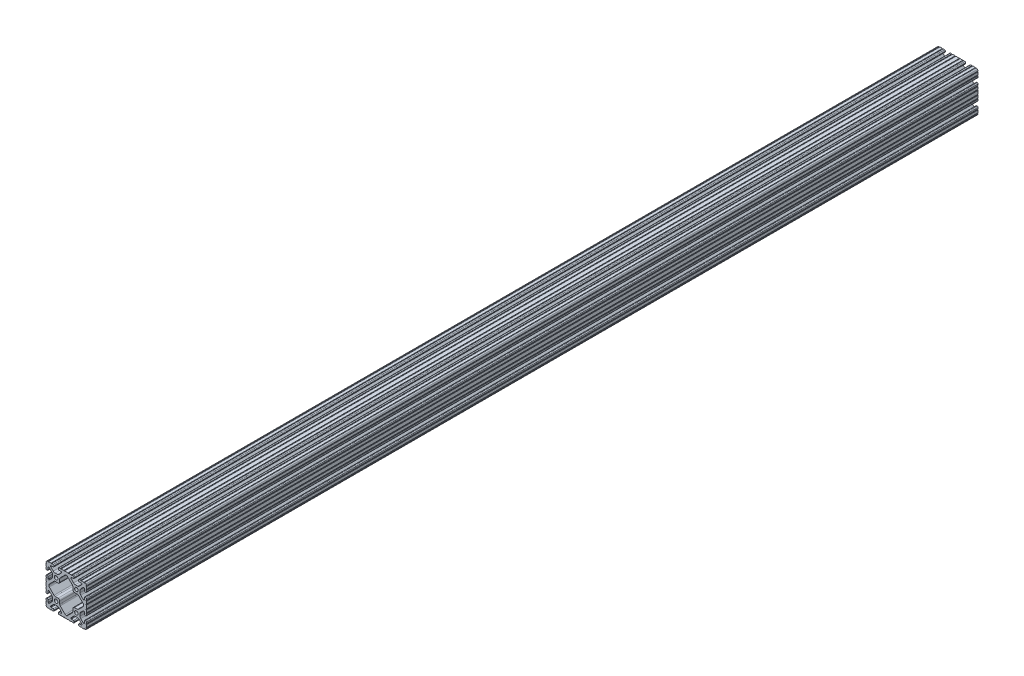
from build123d import *

# Parameters (mm, degrees)
SKETCH1_R           = 3.3274
BOSS_EXTRUDE1_DEPTH = 1676.4


with BuildPart() as part:
    # Sketch1 → Boss-Extrude1 (new body)
    with BuildSketch(Plane(origin=(0, 0, -609.6), x_dir=(-1, 0, 0), z_dir=(0, 0, -1))):
        with BuildLine():
            Line((36.525200182, -23.055396049), (35.610799999, -23.055396049))
            ThreePointArc((35.610799999, -23.055396049), (34.49724824, -23.51664429), (34.035999999, -24.630196049))
            Line((34.035999999, -24.630196049), (34.035999999, -28.448000001))
            ThreePointArc((34.035999999, -28.448000001), (33.775617927, -29.07661793), (33.146999999, -29.337000001))
            Line((33.146999999, -29.337000001), (32.664287243, -29.337000001))
            ThreePointArc((32.664287243, -29.337000001), (32.324081166, -29.269328696), (32.035668541, -29.076617157))
            Line((32.035668541, -29.076617157), (27.197580079, -24.238516795))
            ThreePointArc((27.197580079, -24.238516795), (26.167955878, -22.697572205), (25.806399999, -20.879905136))
            Line((25.806399999, -20.879905136), (25.806399999, -17.220094864))
            ThreePointArc((25.806399999, -17.220094864), (26.167955878, -15.402427795), (27.197580079, -13.861483205))
            Line((27.197580079, -13.861483205), (31.948944539, -9.110107059))
            ThreePointArc((31.948944539, -9.110107059), (32.333417094, -8.853210197), (32.786933647, -8.763000001))
            Line((32.786933647, -8.763000001), (33.060275786, -8.763000001))
            ThreePointArc((33.060275786, -8.763000001), (33.750216993, -9.048783007), (34.035999999, -9.738724214))
            Line((34.035999999, -9.738724214), (34.035999999, -13.469803585))
            ThreePointArc((34.035999999, -13.469803585), (34.497248347, -14.583355602), (35.610800365, -15.044603951))
            Line((35.610800365, -15.044603951), (36.525199999, -15.044603951))
            ThreePointArc((36.525199999, -15.044603951), (37.638751758, -14.58335571), (38.099999999, -13.469803951))
            Line((38.099999999, -13.469803951), (38.099999999, -11.075039291))
            ThreePointArc((38.099999999, -11.075039291), (37.117000249, -10.313517274), (38.099999999, -9.551995256))
            Line((38.099999999, -9.551995256), (38.099999999, -4.723759309))
            ThreePointArc((38.099999999, -4.723759309), (37.117000249, -3.962237291), (38.099999999, -3.200715274))
            Line((38.099999999, -3.200715274), (38.099999999, 3.200715274))
            ThreePointArc((38.099999999, 3.200715274), (37.117000249, 3.962237291), (38.099999999, 4.723759309))
            Line((38.099999999, 4.723759309), (38.099999999, 9.551995254))
            ThreePointArc((38.099999999, 9.551995254), (37.117000249, 10.313517271), (38.099999999, 11.075039288))
            Line((38.099999999, 11.075039288), (38.099999999, 13.469803951))
            ThreePointArc((38.099999999, 13.469803951), (37.638751758, 14.58335571), (36.525199999, 15.044603951))
            Line((36.525199999, 15.044603951), (35.610800365, 15.044603951))
            ThreePointArc((35.610800365, 15.044603951), (34.497248347, 14.583355602), (34.035999999, 13.469803585))
            Line((34.035999999, 13.469803585), (34.035999999, 9.738724211))
            ThreePointArc((34.035999999, 9.738724211), (33.750216993, 9.048783004), (33.060275786, 8.762999999))
            Line((33.060275786, 8.762999999), (32.78693365, 8.762999999))
            ThreePointArc((32.78693365, 8.762999999), (32.333417097, 8.853210195), (31.948944542, 9.110107056))
            Line((31.948944542, 9.110107056), (27.197580079, 13.861483205))
            ThreePointArc((27.197580079, 13.861483205), (26.167955878, 15.402427795), (25.806399999, 17.220094864))
            Line((25.806399999, 17.220094864), (25.806399999, 20.879905136))
            ThreePointArc((25.806399999, 20.879905136), (26.167955878, 22.697572205), (27.19758008, 24.238516796))
            Line((27.19758008, 24.238516796), (32.035668541, 29.076617154))
            ThreePointArc((32.035668541, 29.076617154), (32.324081166, 29.269328694), (32.664287243, 29.336999999))
            Line((32.664287243, 29.336999999), (33.146999999, 29.336999999))
            ThreePointArc((33.146999999, 29.336999999), (33.775617927, 29.076617927), (34.035999999, 28.447999999))
            Line((34.035999999, 28.447999999), (34.035999999, 24.630196049))
            ThreePointArc((34.035999999, 24.630196049), (34.49724824, 23.51664429), (35.610799999, 23.055396049))
            Line((35.610799999, 23.055396049), (36.525200182, 23.055396049))
            ThreePointArc((36.525200182, 23.055396049), (37.638751811, 23.516644237), (38.099999999, 24.630195866))
            Line((38.099999999, 24.630195866), (38.099999999, 27.023826138))
            ThreePointArc((38.099999999, 27.023826138), (37.117780707, 27.7845421), (38.099999999, 28.545258063))
            Line((38.099999999, 28.545258063), (38.099999999, 33.373016026))
            ThreePointArc((38.099999999, 33.373016026), (37.141472622, 34.109236775), (38.1, 34.845457522))
            ThreePointArc((38.1, 34.845457522), (37.837757798, 36.120195039), (37.086123087, 37.182631848))
            ThreePointArc((37.086123087, 37.182631848), (36.106286535, 37.843374412), (34.952681874, 38.099999999))
            ThreePointArc((34.952681874, 38.099999999), (34.190730434, 37.320215334), (33.428778993, 38.099999999))
            Line((33.428778993, 38.099999999), (28.601105934, 38.099999999))
            ThreePointArc((28.601105934, 38.099999999), (27.83915858, 37.320219419), (27.077211226, 38.099999999))
            Line((27.077211226, 38.099999999), (24.688799999, 38.099999999))
            ThreePointArc((24.688799999, 38.099999999), (23.57524824, 37.638751758), (23.113999999, 36.525199999))
            Line((23.113999999, 36.525199999), (23.113999999, 35.610799999))
            ThreePointArc((23.113999999, 35.610799999), (23.57524824, 34.49724824), (24.688799999, 34.035999999))
            Line((24.688799999, 34.035999999), (28.447999999, 34.035999999))
            ThreePointArc((28.447999999, 34.035999999), (29.076617927, 33.775617927), (29.336999999, 33.146999999))
            Line((29.336999999, 33.146999999), (29.336999999, 32.720693457))
            ThreePointArc((29.336999999, 32.720693457), (29.326675076, 32.273872753), (29.100231244, 31.888543625))
            Line((29.100231244, 31.888543625), (24.409287498, 27.19758834))
            ThreePointArc((24.409287498, 27.19758834), (22.868340044, 26.167958113), (21.050667578, 25.806399999))
            Line((21.050667578, 25.806399999), (17.049332422, 25.806399999))
            ThreePointArc((17.049332422, 25.806399999), (15.231659956, 26.167958113), (13.690712502, 27.19758834))
            Line((13.690712502, 27.19758834), (9.023381297, 31.864931026))
            ThreePointArc((9.023381297, 31.864931026), (8.830670885, 32.153343115), (8.762999999, 32.493548181))
            Line((8.762999999, 32.493548181), (8.762999999, 33.146999999))
            ThreePointArc((8.762999999, 33.146999999), (9.02338207, 33.775617927), (9.651999999, 34.035999999))
            Line((9.651999999, 34.035999999), (13.411199999, 34.035999999))
            ThreePointArc((13.411199999, 34.035999999), (14.524751758, 34.49724824), (14.985999999, 35.610799999))
            Line((14.985999999, 35.610799999), (14.985999999, 36.525199999))
            ThreePointArc((14.985999999, 36.525199999), (14.524751758, 37.638751758), (13.411199999, 38.099999999))
            Line((13.411199999, 38.099999999), (11.128867073, 38.099999999))
            ThreePointArc((11.128867073, 38.099999999), (10.367071032, 37.320370692), (9.605274992, 38.099999999))
            Line((9.605274992, 38.099999999), (4.777313068, 38.099999999))
            ThreePointArc((4.777313068, 38.099999999), (4.015517027, 37.320370692), (3.253720987, 38.099999999))
            Line((3.253720987, 38.099999999), (-3.253720989, 38.099999999))
            ThreePointArc((-3.253720989, 38.099999999), (-4.01551703, 37.320370692), (-4.777313071, 38.099999999))
            Line((-4.777313071, 38.099999999), (-9.605274992, 38.099999999))
            ThreePointArc((-9.605274992, 38.099999999), (-10.367071032, 37.320370692), (-11.128867073, 38.099999999))
            Line((-11.128867073, 38.099999999), (-13.411200001, 38.099999999))
            ThreePointArc((-13.411200001, 38.099999999), (-14.52475176, 37.638751758), (-14.986000001, 36.525199999))
            Line((-14.986000001, 36.525199999), (-14.986000001, 35.610799999))
            ThreePointArc((-14.986000001, 35.610799999), (-14.52475176, 34.49724824), (-13.411200001, 34.035999999))
            Line((-13.411200001, 34.035999999), (-9.652000001, 34.035999999))
            ThreePointArc((-9.652000001, 34.035999999), (-9.023382073, 33.775617927), (-8.763000001, 33.146999999))
            Line((-8.763000001, 33.146999999), (-8.763000001, 32.493548178))
            ThreePointArc((-8.763000001, 32.493548178), (-8.830670888, 32.153343112), (-9.0233813, 31.864931023))
            Line((-9.0233813, 31.864931023), (-13.690712502, 27.19758834))
            ThreePointArc((-13.690712502, 27.19758834), (-15.231659956, 26.167958113), (-17.049332422, 25.806399999))
            Line((-17.049332422, 25.806399999), (-21.050667578, 25.806399999))
            ThreePointArc((-21.050667578, 25.806399999), (-22.868340044, 26.167958113), (-24.409287498, 27.19758834))
            Line((-24.409287498, 27.19758834), (-29.100231244, 31.888543625))
            ThreePointArc((-29.100231244, 31.888543625), (-29.326675074, 32.273872748), (-29.337000001, 32.720693446))
            Line((-29.337000001, 32.720693446), (-29.337000001, 33.146999999))
            ThreePointArc((-29.337000001, 33.146999999), (-29.07661793, 33.775617927), (-28.448000001, 34.035999999))
            Line((-28.448000001, 34.035999999), (-24.688800001, 34.035999999))
            ThreePointArc((-24.688800001, 34.035999999), (-23.575248242, 34.49724824), (-23.114000001, 35.610799999))
            Line((-23.114000001, 35.610799999), (-23.114000001, 36.525199999))
            ThreePointArc((-23.114000001, 36.525199999), (-23.575248242, 37.638751758), (-24.688800001, 38.099999999))
            Line((-24.688800001, 38.099999999), (-27.077211226, 38.099999999))
            ThreePointArc((-27.077211226, 38.099999999), (-27.83915858, 37.320219419), (-28.601105934, 38.099999999))
            Line((-28.601105934, 38.099999999), (-33.428778993, 38.099999999))
            ThreePointArc((-33.428778993, 38.099999999), (-34.190730434, 37.320215334), (-34.952681874, 38.099999999))
            ThreePointArc((-34.952681874, 38.099999999), (-36.106286561, 37.843374402), (-37.086123128, 37.18263181))
            ThreePointArc((-37.086123128, 37.18263181), (-37.837757809, 36.120195013), (-38.1, 34.845457522))
            ThreePointArc((-38.1, 34.845457522), (-37.141472622, 34.109236773), (-38.100000001, 33.373016026))
            Line((-38.100000001, 33.373016026), (-38.100000001, 28.545258062))
            ThreePointArc((-38.100000001, 28.545258062), (-37.117780707, 27.7845421), (-38.100000001, 27.023826138))
            Line((-38.100000001, 27.023826138), (-38.100000001, 24.630195866))
            ThreePointArc((-38.100000001, 24.630195866), (-37.638751814, 23.516644237), (-36.525200184, 23.055396049))
            Line((-36.525200184, 23.055396049), (-35.610800001, 23.055396049))
            ThreePointArc((-35.610800001, 23.055396049), (-34.497248242, 23.51664429), (-34.036000001, 24.630196049))
            Line((-34.036000001, 24.630196049), (-34.036000001, 28.447999999))
            ThreePointArc((-34.036000001, 28.447999999), (-33.77561793, 29.076617927), (-33.147000001, 29.336999999))
            Line((-33.147000001, 29.336999999), (-32.664287243, 29.336999999))
            ThreePointArc((-32.664287243, 29.336999999), (-32.324081166, 29.269328694), (-32.035668541, 29.076617154))
            Line((-32.035668541, 29.076617154), (-27.197580082, 24.238516798))
            ThreePointArc((-27.197580082, 24.238516798), (-26.16795588, 22.697572208), (-25.806400001, 20.879905138))
            Line((-25.806400001, 20.879905138), (-25.806400001, 17.220094862))
            ThreePointArc((-25.806400001, 17.220094862), (-26.16795588, 15.402427793), (-27.197580082, 13.861483203))
            Line((-27.197580082, 13.861483203), (-31.948944542, 9.110107056))
            ThreePointArc((-31.948944542, 9.110107056), (-32.333417097, 8.853210195), (-32.78693365, 8.762999999))
            Line((-32.78693365, 8.762999999), (-33.060275789, 8.762999999))
            ThreePointArc((-33.060275789, 8.762999999), (-33.750216996, 9.048783004), (-34.036000001, 9.738724211))
            Line((-34.036000001, 9.738724211), (-34.036000001, 13.469803585))
            ThreePointArc((-34.036000001, 13.469803585), (-34.497248349, 14.583355602), (-35.610800367, 15.044603951))
            Line((-35.610800367, 15.044603951), (-36.525200001, 15.044603951))
            ThreePointArc((-36.525200001, 15.044603951), (-37.63875176, 14.58335571), (-38.100000001, 13.469803951))
            Line((-38.100000001, 13.469803951), (-38.100000001, 11.075039288))
            ThreePointArc((-38.100000001, 11.075039288), (-37.117000249, 10.313517271), (-38.100000001, 9.551995254))
            Line((-38.100000001, 9.551995254), (-38.100000001, 4.723759308))
            ThreePointArc((-38.100000001, 4.723759308), (-37.117000249, 3.962237291), (-38.100000001, 3.200715275))
            Line((-38.100000001, 3.200715275), (-38.100000001, -3.200715275))
            ThreePointArc((-38.100000001, -3.200715275), (-37.117000249, -3.962237291), (-38.100000001, -4.723759308))
            Line((-38.100000001, -4.723759308), (-38.100000001, -9.551995257))
            ThreePointArc((-38.100000001, -9.551995257), (-37.117000249, -10.313517274), (-38.100000001, -11.07503929))
            Line((-38.100000001, -11.07503929), (-38.100000001, -13.469803951))
            ThreePointArc((-38.100000001, -13.469803951), (-37.63875176, -14.58335571), (-36.525200001, -15.044603951))
            Line((-36.525200001, -15.044603951), (-35.610800367, -15.044603951))
            ThreePointArc((-35.610800367, -15.044603951), (-34.497248349, -14.583355602), (-34.036000001, -13.469803585))
            Line((-34.036000001, -13.469803585), (-34.036000001, -9.738724214))
            ThreePointArc((-34.036000001, -9.738724214), (-33.750216996, -9.048783007), (-33.060275789, -8.763000001))
            Line((-33.060275789, -8.763000001), (-32.786933647, -8.763000001))
            ThreePointArc((-32.786933647, -8.763000001), (-32.333417094, -8.853210197), (-31.948944539, -9.110107059))
            Line((-31.948944539, -9.110107059), (-27.197580082, -13.861483203))
            ThreePointArc((-27.197580082, -13.861483203), (-26.16795588, -15.402427793), (-25.806400001, -17.220094862))
            Line((-25.806400001, -17.220094862), (-25.806400001, -20.879905138))
            ThreePointArc((-25.806400001, -20.879905138), (-26.16795588, -22.697572207), (-27.197580082, -24.238516797))
            Line((-27.197580082, -24.238516797), (-32.035668541, -29.076617157))
            ThreePointArc((-32.035668541, -29.076617157), (-32.324081166, -29.269328696), (-32.664287243, -29.337000001))
            Line((-32.664287243, -29.337000001), (-33.147000001, -29.337000001))
            ThreePointArc((-33.147000001, -29.337000001), (-33.77561793, -29.07661793), (-34.036000001, -28.448000001))
            Line((-34.036000001, -28.448000001), (-34.036000001, -24.630196049))
            ThreePointArc((-34.036000001, -24.630196049), (-34.497248242, -23.51664429), (-35.610800001, -23.055396049))
            Line((-35.610800001, -23.055396049), (-36.525200184, -23.055396049))
            ThreePointArc((-36.525200184, -23.055396049), (-37.638751814, -23.516644237), (-38.100000001, -24.630195866))
            Line((-38.100000001, -24.630195866), (-38.100000001, -27.023826138))
            ThreePointArc((-38.100000001, -27.023826138), (-37.117780707, -27.7845421), (-38.100000001, -28.545258062))
            Line((-38.100000001, -28.545258062), (-38.100000001, -33.373016026))
            ThreePointArc((-38.100000001, -33.373016026), (-37.141472622, -34.109236773), (-38.1, -34.845457522))
            ThreePointArc((-38.1, -34.845457522), (-37.83775782, -36.120194987), (-37.086123169, -37.182631771))
            ThreePointArc((-37.086123169, -37.182631771), (-36.106286588, -37.843374393), (-34.952681874, -38.100000001))
            ThreePointArc((-34.952681874, -38.100000001), (-34.190730434, -37.320215336), (-33.428778993, -38.100000001))
            Line((-33.428778993, -38.100000001), (-28.601105934, -38.100000001))
            ThreePointArc((-28.601105934, -38.100000001), (-27.83915858, -37.320219421), (-27.077211226, -38.100000001))
            Line((-27.077211226, -38.100000001), (-24.688800001, -38.100000001))
            ThreePointArc((-24.688800001, -38.100000001), (-23.575248242, -37.63875176), (-23.114000001, -36.525200001))
            Line((-23.114000001, -36.525200001), (-23.114000001, -35.610800001))
            ThreePointArc((-23.114000001, -35.610800001), (-23.575248242, -34.497248242), (-24.688800001, -34.036000001))
            Line((-24.688800001, -34.036000001), (-28.448000001, -34.036000001))
            ThreePointArc((-28.448000001, -34.036000001), (-29.07661793, -33.77561793), (-29.337000001, -33.147000001))
            Line((-29.337000001, -33.147000001), (-29.337000001, -32.720693446))
            ThreePointArc((-29.337000001, -32.720693446), (-29.326675074, -32.273872748), (-29.100231244, -31.888543625))
            Line((-29.100231244, -31.888543625), (-24.409287501, -27.197588343))
            ThreePointArc((-24.409287501, -27.197588343), (-22.868340046, -26.167958116), (-21.050667581, -25.806400001))
            Line((-21.050667581, -25.806400001), (-17.049332419, -25.806400001))
            ThreePointArc((-17.049332419, -25.806400001), (-15.231659954, -26.167958116), (-13.690712499, -27.197588343))
            Line((-13.690712499, -27.197588343), (-9.0233813, -31.864931023))
            ThreePointArc((-9.0233813, -31.864931023), (-8.830670888, -32.153343112), (-8.763000001, -32.493548178))
            Line((-8.763000001, -32.493548178), (-8.763000001, -33.147000001))
            ThreePointArc((-8.763000001, -33.147000001), (-9.023382073, -33.77561793), (-9.652000001, -34.036000001))
            Line((-9.652000001, -34.036000001), (-13.411200001, -34.036000001))
            ThreePointArc((-13.411200001, -34.036000001), (-14.52475176, -34.497248242), (-14.986000001, -35.610800001))
            Line((-14.986000001, -35.610800001), (-14.986000001, -36.525200001))
            ThreePointArc((-14.986000001, -36.525200001), (-14.52475176, -37.63875176), (-13.411200001, -38.100000001))
            Line((-13.411200001, -38.100000001), (-11.128867073, -38.100000001))
            ThreePointArc((-11.128867073, -38.100000001), (-10.367071032, -37.320370694), (-9.605274992, -38.100000001))
            Line((-9.605274992, -38.100000001), (-4.777313071, -38.100000001))
            ThreePointArc((-4.777313071, -38.100000001), (-4.01551703, -37.320370694), (-3.253720989, -38.100000001))
            Line((-3.253720989, -38.100000001), (3.253720987, -38.100000001))
            ThreePointArc((3.253720987, -38.100000001), (4.015517027, -37.320370694), (4.777313068, -38.100000001))
            Line((4.777313068, -38.100000001), (9.605274992, -38.100000001))
            ThreePointArc((9.605274992, -38.100000001), (10.367071032, -37.320370694), (11.128867073, -38.100000001))
            Line((11.128867073, -38.100000001), (13.411199999, -38.100000001))
            ThreePointArc((13.411199999, -38.100000001), (14.524751758, -37.63875176), (14.985999999, -36.525200001))
            Line((14.985999999, -36.525200001), (14.985999999, -35.610800001))
            ThreePointArc((14.985999999, -35.610800001), (14.524751758, -34.497248242), (13.411199999, -34.036000001))
            Line((13.411199999, -34.036000001), (9.651999999, -34.036000001))
            ThreePointArc((9.651999999, -34.036000001), (9.02338207, -33.77561793), (8.762999999, -33.147000001))
            Line((8.762999999, -33.147000001), (8.762999999, -32.493548181))
            ThreePointArc((8.762999999, -32.493548181), (8.830670885, -32.153343115), (9.023381297, -31.864931026))
            Line((9.023381297, -31.864931026), (13.690712499, -27.197588343))
            ThreePointArc((13.690712499, -27.197588343), (15.231659954, -26.167958116), (17.049332419, -25.806400001))
            Line((17.049332419, -25.806400001), (21.050667581, -25.806400001))
            ThreePointArc((21.050667581, -25.806400001), (22.868340046, -26.167958116), (24.409287501, -27.197588343))
            Line((24.409287501, -27.197588343), (29.100231244, -31.888543625))
            ThreePointArc((29.100231244, -31.888543625), (29.326675076, -32.273872753), (29.336999999, -32.720693457))
            Line((29.336999999, -32.720693457), (29.336999999, -33.147000001))
            ThreePointArc((29.336999999, -33.147000001), (29.076617927, -33.77561793), (28.447999999, -34.036000001))
            Line((28.447999999, -34.036000001), (24.688799999, -34.036000001))
            ThreePointArc((24.688799999, -34.036000001), (23.57524824, -34.497248242), (23.113999999, -35.610800001))
            Line((23.113999999, -35.610800001), (23.113999999, -36.525200001))
            ThreePointArc((23.113999999, -36.525200001), (23.57524824, -37.63875176), (24.688799999, -38.100000001))
            Line((24.688799999, -38.100000001), (27.077211226, -38.100000001))
            ThreePointArc((27.077211226, -38.100000001), (27.83915858, -37.320219421), (28.601105934, -38.100000001))
            Line((28.601105934, -38.100000001), (33.428778993, -38.100000001))
            ThreePointArc((33.428778993, -38.100000001), (34.190730434, -37.320215336), (34.952681874, -38.100000001))
            ThreePointArc((34.952681874, -38.100000001), (36.106286561, -37.843374403), (37.086123128, -37.182631809))
            ThreePointArc((37.086123128, -37.182631809), (37.837757809, -36.120195013), (38.1, -34.845457522))
            ThreePointArc((38.1, -34.845457522), (37.141472622, -34.109236775), (38.099999999, -33.373016026))
            Line((38.099999999, -33.373016026), (38.099999999, -28.545258063))
            ThreePointArc((38.099999999, -28.545258063), (37.117780707, -27.7845421), (38.099999999, -27.023826138))
            Line((38.099999999, -27.023826138), (38.099999999, -24.630195866))
            ThreePointArc((38.099999999, -24.630195866), (37.638751811, -23.516644237), (36.525200182, -23.055396049))
        make_face()
        with Locations(Location((19.049999999, -19.050000001, 0), (0, 0, 180))):
            Circle(SKETCH1_R, mode=Mode.SUBTRACT)
        with Locations(Location((19.049999999, 19.049999999, 0), (0, 0, 180))):
            Circle(SKETCH1_R, mode=Mode.SUBTRACT)
        with Locations(Location((-19.050000001, 19.049999999, 0), (0, 0, 180))):
            Circle(SKETCH1_R, mode=Mode.SUBTRACT)
        with Locations(Location((-19.050000001, -19.050000001, 0), (0, 0, 180))):
            Circle(SKETCH1_R, mode=Mode.SUBTRACT)
        with BuildLine():
            Line((31.902125566, -2.475607376), (23.014093535, -11.36366127))
            ThreePointArc((23.014093535, -11.36366127), (21.984048445, -12.05191677), (20.769026744, -12.293600001))
            Line((20.769026744, -12.293600001), (15.468599999, -12.293600001))
            ThreePointArc((15.468599999, -12.293600001), (13.223535968, -13.223535971), (12.293599999, -15.468600001))
            Line((12.293599999, -15.468600001), (12.293599999, -20.598259734))
            ThreePointArc((12.293599999, -20.598259734), (12.051918262, -21.813277828), (11.36366679, -22.843321004))
            Line((11.36366679, -22.843321004), (2.051515951, -32.155494748))
            ThreePointArc((2.051515951, -32.155494748), (1.11031328, -32.786013752), (0, -33.011005091))
            ThreePointArc((0, -33.011005091), (-1.11031328, -32.786013752), (-2.051515951, -32.155494748))
            Line((-2.051515951, -32.155494748), (-11.363666793, -22.843321001))
            ThreePointArc((-11.363666793, -22.843321001), (-12.051918264, -21.813277826), (-12.293600001, -20.598259732))
            Line((-12.293600001, -20.598259732), (-12.293600001, -15.468600001))
            ThreePointArc((-12.293600001, -15.468600001), (-13.223535971, -13.223535971), (-15.468600001, -12.293600001))
            Line((-15.468600001, -12.293600001), (-20.769026744, -12.293600001))
            ThreePointArc((-20.769026744, -12.293600001), (-21.984048445, -12.05191677), (-23.014093535, -11.36366127))
            Line((-23.014093535, -11.36366127), (-31.902125566, -2.475607376))
            ThreePointArc((-31.902125566, -2.475607376), (-32.607298578, -1.335259481), (-32.728725173, 0))
            ThreePointArc((-32.728725173, 0), (-32.607298578, 1.335259481), (-31.902125566, 2.475607376))
            Line((-31.902125566, 2.475607376), (-23.014093538, 11.363661268))
            ThreePointArc((-23.014093538, 11.363661268), (-21.984048448, 12.051916767), (-20.769026746, 12.293599999))
            Line((-20.769026746, 12.293599999), (-15.468600001, 12.293599999))
            ThreePointArc((-15.468600001, 12.293599999), (-13.223535971, 13.223535968), (-12.293600001, 15.468599999))
            Line((-12.293600001, 15.468599999), (-12.293600001, 20.598259732))
            ThreePointArc((-12.293600001, 20.598259732), (-12.051918264, 21.813277826), (-11.363666793, 22.843321001))
            Line((-11.363666793, 22.843321001), (-2.051515951, 32.155494748))
            ThreePointArc((-2.051515951, 32.155494748), (-1.11031328, 32.786013752), (0, 33.011005091))
            ThreePointArc((0, 33.011005091), (1.11031328, 32.786013752), (2.051515951, 32.155494748))
            Line((2.051515951, 32.155494748), (11.36366679, 22.843321004))
            ThreePointArc((11.36366679, 22.843321004), (12.051918262, 21.813277828), (12.293599999, 20.598259734))
            Line((12.293599999, 20.598259734), (12.293599999, 15.468599999))
            ThreePointArc((12.293599999, 15.468599999), (13.223535968, 13.223535968), (15.468599999, 12.293599999))
            Line((15.468599999, 12.293599999), (20.769026746, 12.293599999))
            ThreePointArc((20.769026746, 12.293599999), (21.984048448, 12.051916767), (23.014093538, 11.363661268))
            Line((23.014093538, 11.363661268), (31.902125566, 2.475607376))
            ThreePointArc((31.902125566, 2.475607376), (32.607298578, 1.335259481), (32.728725173, 0))
            ThreePointArc((32.728725173, 0), (32.607298578, -1.335259481), (31.902125566, -2.475607376))
        make_face(mode=Mode.SUBTRACT)
    extrude(amount=-BOSS_EXTRUDE1_DEPTH)


solid = part.part
